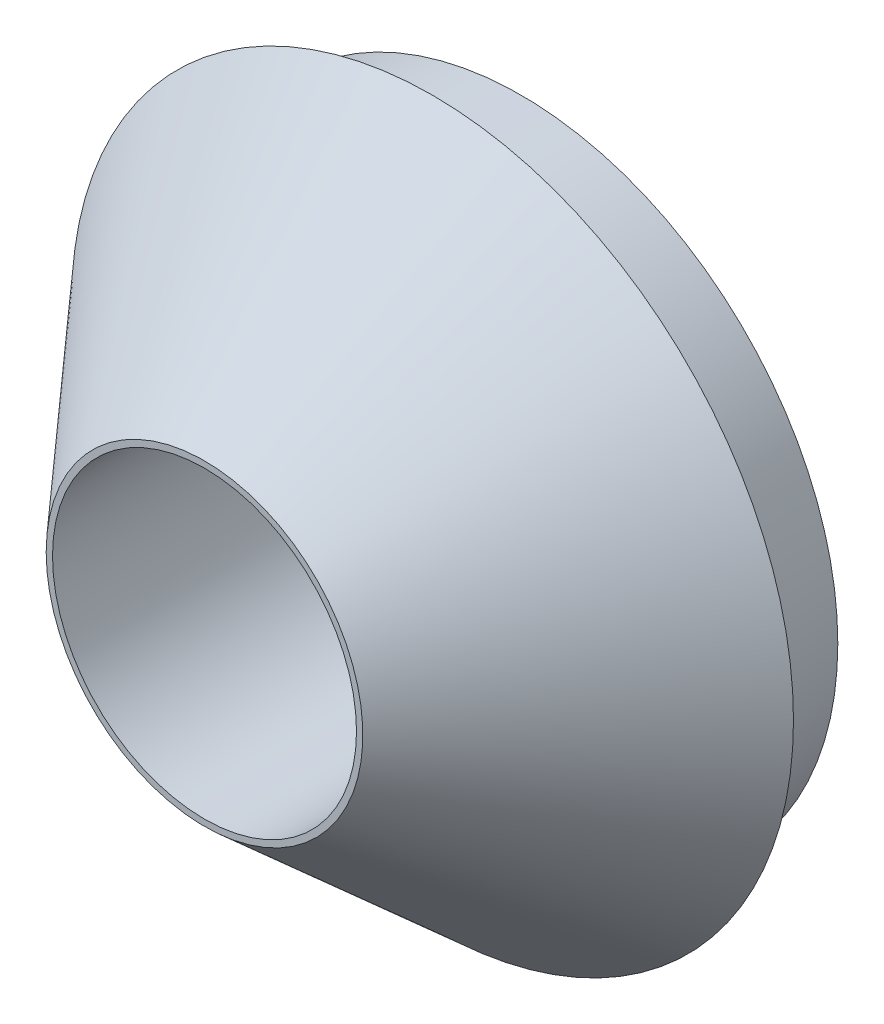
from build123d import *

# Parameters (mm, degrees)
SKETCH2_R          = 6.096
CUT_EXTRUDE1_DEPTH = 12.7


with BuildPart() as part:
    # Sketch1 → Revolve1 (revolve)
    with BuildSketch(Plane(origin=(0, 0, 0), x_dir=(1, 0, 0), z_dir=(0, 1, 0)), mode=Mode.PRIVATE) as revolve1_sk:
        Polygon((0, 0), (6.35, 0), (14.478, 9.144), (12.7, 9.144), (12.7, 12.7), (0, 12.7), align=None)
    revolve(revolve1_sk.sketch.rotate(Axis((0, 0, -12.7), (0, 0, 1)), 180), axis=Axis((0, 0, -12.7), (0, 0, 1)))

    # Sketch2 → Cut-Extrude1 (cut)
    with BuildSketch(Plane(origin=(0, 0, -12.7), x_dir=(-1, 0, 0), z_dir=(0, 0, -1))):
        Circle(SKETCH2_R)
    extrude(amount=-CUT_EXTRUDE1_DEPTH, mode=Mode.SUBTRACT)


solid = part.part
